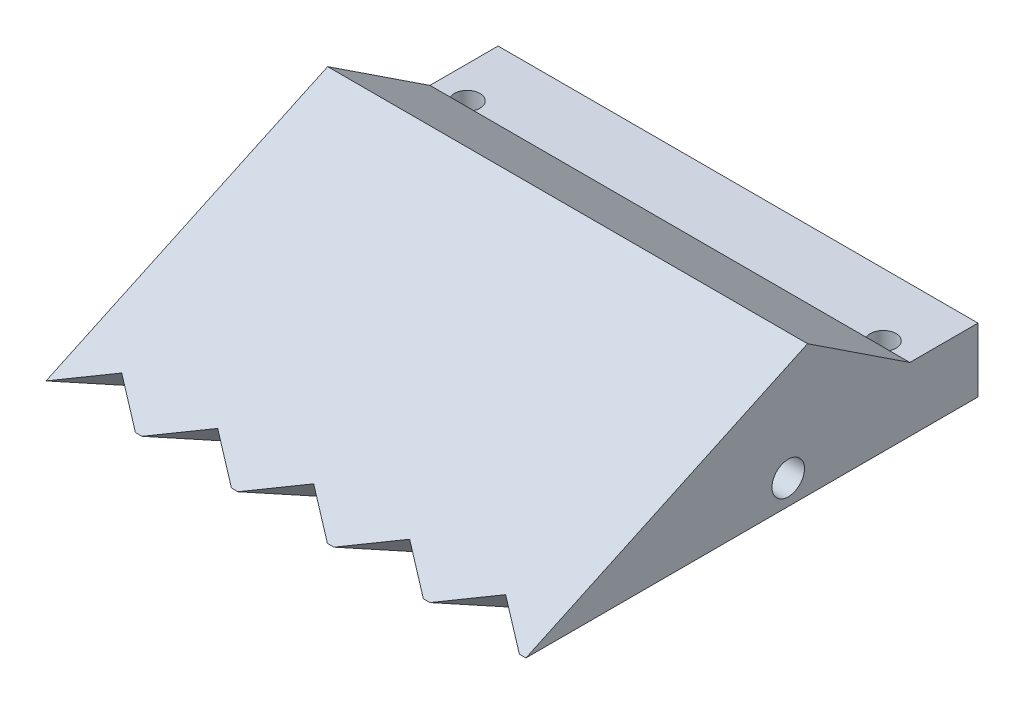
from build123d import *

# Parameters (mm, degrees)
BOSS_EXTRUDE1_DEPTH = 75
SKETCH2_R           = 2
CUT_EXTRUDE1_DEPTH  = 10
CUT_EXTRUDE2_DEPTH  = 10
SKETCH3_R           = 2.543008444
CUT_EXTRUDE3_DEPTH  = 100
CHAMFER1_SIZE       = 2


with BuildPart() as part:
    # Sketch1 → Boss-Extrude1 (new body)
    with BuildSketch(Plane(origin=(0, 0, 0), x_dir=(0, 0, -1), z_dir=(1, 0, 0))):
        Polygon((-35.447605249, 4.173188871), (35.206481481, 4.173188871), (35.206481481, 14.173188871), (24.552394751, 14.173188871), (8.571096195, 24.699446456), align=None)
    extrude(amount=BOSS_EXTRUDE1_DEPTH)

    # Sketch2 → Cut-Extrude1 (cut)
    with BuildSketch(Plane(origin=(0, 14.173188871, 0), x_dir=(1, 0, 0), z_dir=(0, 1, 0))):
        with Locations(Location((5, 25.374559272, 0), (0, 0, 270))):
            Circle(SKETCH2_R)
        with Locations(Location((69.999998904, 25.386498054, 0), (0, 0, 270))):
            Circle(SKETCH2_R)
    extrude(amount=-CUT_EXTRUDE1_DEPTH, mode=Mode.SUBTRACT)

    # Sketch4 → Cut-Extrude2 (cut)
    with BuildSketch(Plane(origin=(0, 17.005051997, 7.929585973), x_dir=(1, 0, 0), z_dir=(0, 0.9063077870366527, 0.42261826174069383))):
        Polygon((0, -30.362774842), (7.065850082, -25.103103439), (13.976560291, -30.362774842), align=None)
        Polygon((22.065850082, -25.103103439), (28.976560291, -30.362774842), (15, -30.362774842), align=None)
        Polygon((37.065850082, -25.103103439), (43.976560291, -30.362774842), (30, -30.362774842), align=None)
        Polygon((52.065850082, -25.103103439), (58.976560291, -30.362774842), (45, -30.362774842), align=None)
        Polygon((67.065850082, -25.103103439), (73.976560291, -30.362774842), (60, -30.362774842), align=None)
    extrude(amount=-CUT_EXTRUDE2_DEPTH, mode=Mode.SUBTRACT)

    # Sketch3 → Cut-Extrude3 (cut)
    with BuildSketch(Plane.ZY):
        with Locations((-5.547587106, 8.033515635)):
            Circle(SKETCH3_R)
    extrude(amount=-CUT_EXTRUDE3_DEPTH, mode=Mode.SUBTRACT)

    # Chamfer1
    chamfer1_edges = [part.edges().sort_by_distance(p)[0] for p in [
        (5, 4.173188871, -27.374559272),
        (69.999998904, 4.173188871, -27.386498054),
    ]]
    chamfer(chamfer1_edges, length=CHAMFER1_SIZE)


solid = part.part
